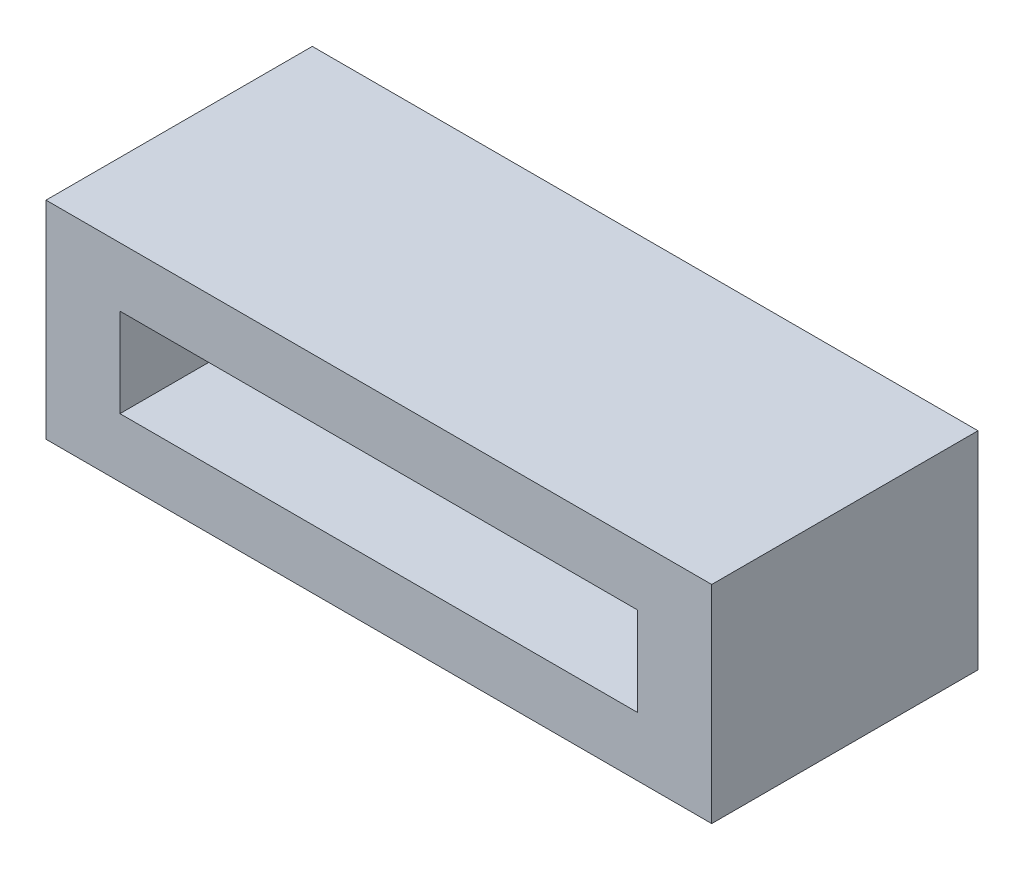
from build123d import *

# Parameters (mm, degrees)
SKETCH1_W           = 45
SKETCH1_H           = 14
SKETCH1_W_2         = 35
SKETCH1_H_2         = 6
BOSS_EXTRUDE1_DEPTH = 18


with BuildPart() as part:
    # Sketch1 → Boss-Extrude1 (new body)
    with BuildSketch(Plane.XY):
        Rectangle(SKETCH1_W, SKETCH1_H)
        Rectangle(SKETCH1_W_2, SKETCH1_H_2, mode=Mode.SUBTRACT)
    extrude(amount=BOSS_EXTRUDE1_DEPTH)


solid = part.part
